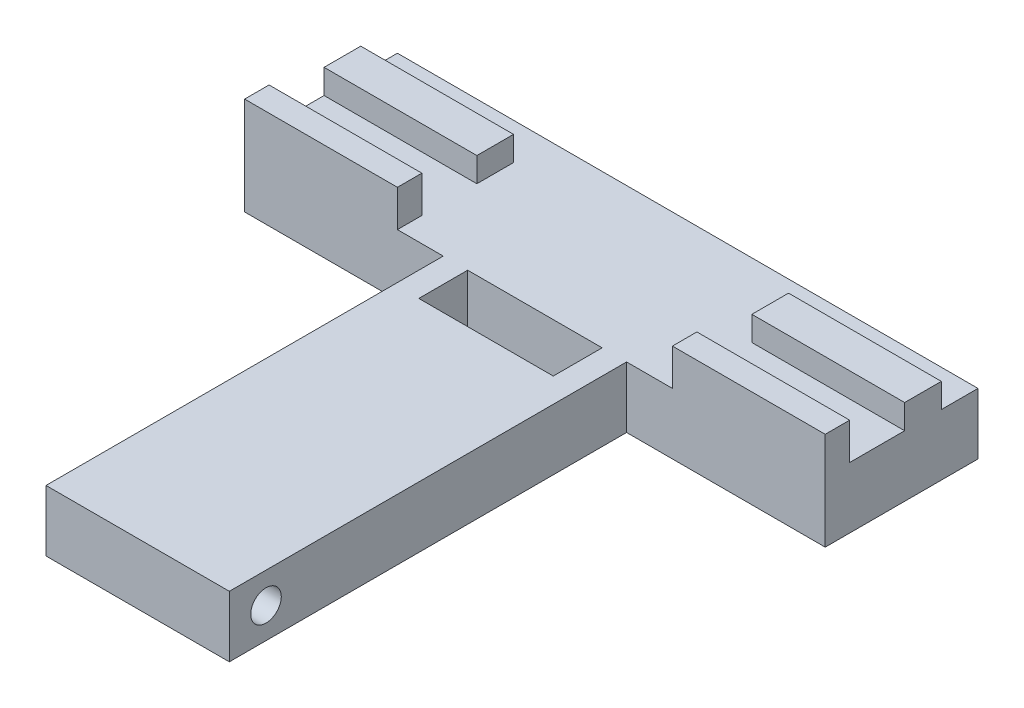
from build123d import *

# Parameters (mm, degrees)
BOSS_EXTRUDE1_DEPTH     = 5
SKETCH2_R               = 1.25
CUT_EXTRUDE2_DEPTH      = 56.014202712
CUT_EXTRUDE3_DEPTH      = 56.014202712
CUT_EXTRUDE3_DEPTH_BACK = 56.014202712
SKETCH6_W               = 11
SKETCH6_H               = 4
SKETCH8_W               = 3
SKETCH8_H               = 2
BOSS_EXTRUDE4_DEPTH     = 47.5
SKETCH9_W               = 22.5
SKETCH9_H               = 3
CUT_EXTRUDE5_DEPTH      = 48.5


with BuildPart() as part:
    # Sketch1 → Boss-Extrude1 (new body)
    with BuildSketch(Plane(origin=(0, 0, 0), x_dir=(1, 0, 0), z_dir=(0, 1, 0))):
        Polygon((0, 0), (15, 0), (15, 35), (31.25, 35), (31.25, 45), (-16.25, 45), (-16.25, 35), (0, 35), align=None)
    extrude(amount=BOSS_EXTRUDE1_DEPTH)

    # Sketch2 → Cut-Extrude2 (cut, through all)
    with BuildSketch(Plane(origin=(15, 0, 0), x_dir=(0, 0, -1), z_dir=(1, 0, 0))):
        with Locations((3, 2.5)):
            Circle(SKETCH2_R)
    extrude(amount=-CUT_EXTRUDE2_DEPTH, mode=Mode.SUBTRACT)

    # Sketch6 → Cut-Extrude3 (cut, two sides: drawn at the far end of the back side and taken through both)
    with BuildSketch(Plane.XZ.offset(-CUT_EXTRUDE3_DEPTH_BACK)):
        with Locations((7.5, -30.5)):
            Rectangle(SKETCH6_W, SKETCH6_H)
    extrude(amount=CUT_EXTRUDE3_DEPTH + CUT_EXTRUDE3_DEPTH_BACK, mode=Mode.SUBTRACT)

    # Sketch8 → Boss-Extrude4 (add)
    with BuildSketch(Plane(origin=(31.25, 0, 0), x_dir=(0, 0, -1), z_dir=(1, 0, 0))):
        with Locations((40.5, 6)):
            Rectangle(SKETCH8_W, SKETCH8_H)
        Polygon((34.5, 8), (32.5, 8), (32.5, 0), (35, 0), (35, 5), (34.5, 5), align=None)
    extrude(amount=-BOSS_EXTRUDE4_DEPTH)

    # Sketch9 → Cut-Extrude5 (cut)
    with BuildSketch(Plane.XY.offset(-32.5)):
        with Locations((7.5, 6.5)):
            Rectangle(SKETCH9_W, SKETCH9_H)
    extrude(amount=-CUT_EXTRUDE5_DEPTH, mode=Mode.SUBTRACT)


solid = part.part
